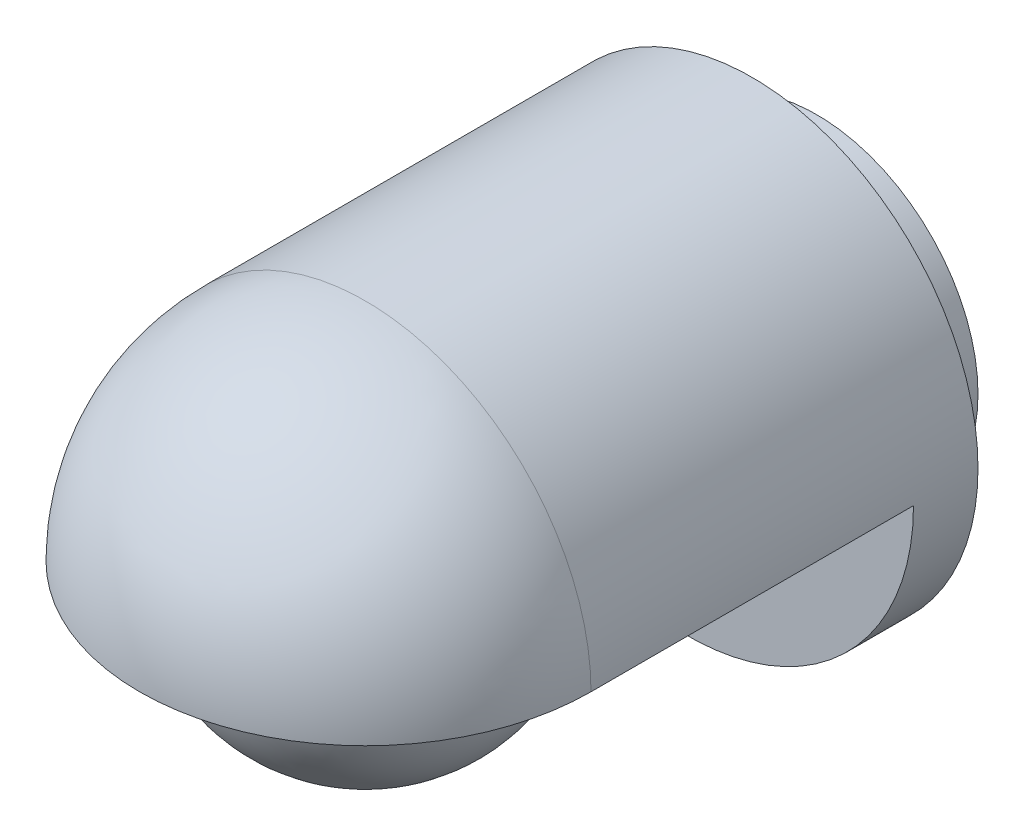
from build123d import *

# Parameters (mm, degrees)
REVOLVE2_ANGLE      = 180
SKETCH3_R           = 50
BOSS_EXTRUDE1_DEPTH = 20
SKETCH4_R           = 70
BOSS_EXTRUDE2_DEPTH = 20


with BuildPart() as part:
    # Sketch1 → Revolve1 (revolve)
    with BuildSketch(Plane(origin=(0, 0, 0), x_dir=(1, 0, 0), z_dir=(0, 1, 0))):
        with BuildLine():
            Line((0, 50), (0, -50))
            ThreePointArc((0, -50), (-50, 0), (0, 50))
        make_face()
    revolve(axis=Axis((0, 0, -50), (0, 0, 1)))

    # Sketch2 → Revolve2 (revolve)
    with BuildSketch(Plane(origin=(0, 0, 0), x_dir=(1, 0, 0), z_dir=(0, 1, 0))):
        with BuildLine():
            Line((0, 120), (0, -70))
            ThreePointArc((0, -70), (-49.497474683, -49.497474683), (-70, 0))
            Line((-70, 0), (-70, 120))
            Line((-70, 120), (0, 120))
        make_face()
    revolve(axis=Axis((0, 0, -120), (0, 0, -1)), revolution_arc=REVOLVE2_ANGLE)

    # Sketch3 → Boss-Extrude1 (add)
    with BuildSketch(Plane(origin=(0, 0, -120), x_dir=(-1, 0, 0), z_dir=(0, 0, -1))):
        Circle(SKETCH3_R)
    extrude(amount=BOSS_EXTRUDE1_DEPTH)

    # Sketch4 → Boss-Extrude2 (add)
    with BuildSketch(Plane(origin=(0, 0, -120), x_dir=(-1, 0, 0), z_dir=(0, 0, -1))):
        with Locations(Location((0, 0, 0), (0, 0, 180))):
            Circle(SKETCH4_R)
    extrude(amount=-BOSS_EXTRUDE2_DEPTH)


solid = part.part
